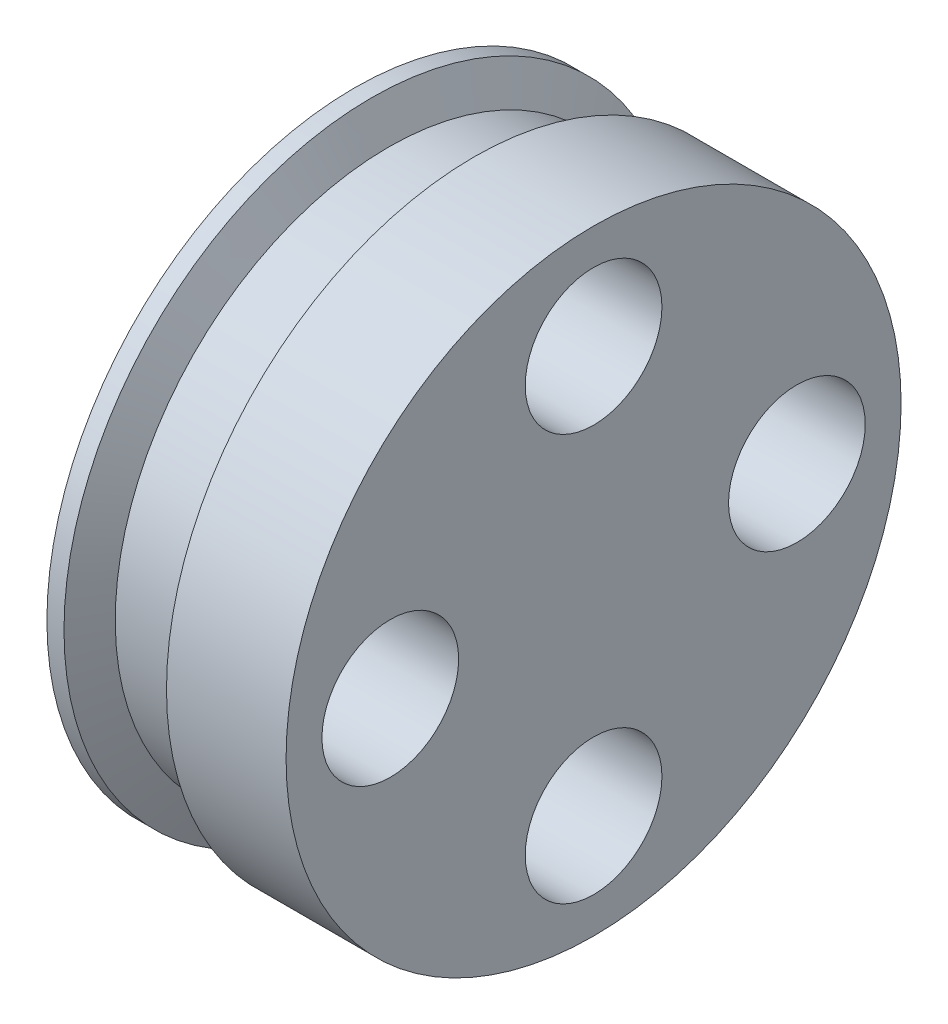
from build123d import *

# Parameters (mm, degrees)
ESQUISSE2_R             = 2
ENL_V_MAT_EXTRU_1_DEPTH = 10


with BuildPart() as part:
    # Esquisse1 → Révolution1 (revolve)
    with BuildSketch(Plane.XY):
        Polygon((0, 0), (0, 9), (0.5, 9), (1, 8), (3, 8), (3.5, 9), (4, 9), (7, 9), (7, 0), (4, 0), align=None)
    revolve(axis=Axis((4, 0, 0), (-1, 0, 0)))

    # Esquisse2 → Enlèv. mat.-Extru.1 (cut)
    with BuildSketch(Plane.ZY):
        with Locations(Location((0, 5.95, 0), (0, 0, 270))):
            Circle(ESQUISSE2_R)
        with Locations(Location((5.95, 0, 0), (0, 0, 270))):
            Circle(ESQUISSE2_R)
        with Locations(Location((0, -5.95, 0), (0, 0, 270))):
            Circle(ESQUISSE2_R)
        with Locations(Location((-5.95, 0, 0), (0, 0, 270))):
            Circle(ESQUISSE2_R)
    extrude(amount=-ENL_V_MAT_EXTRU_1_DEPTH, mode=Mode.SUBTRACT)


solid = part.part
